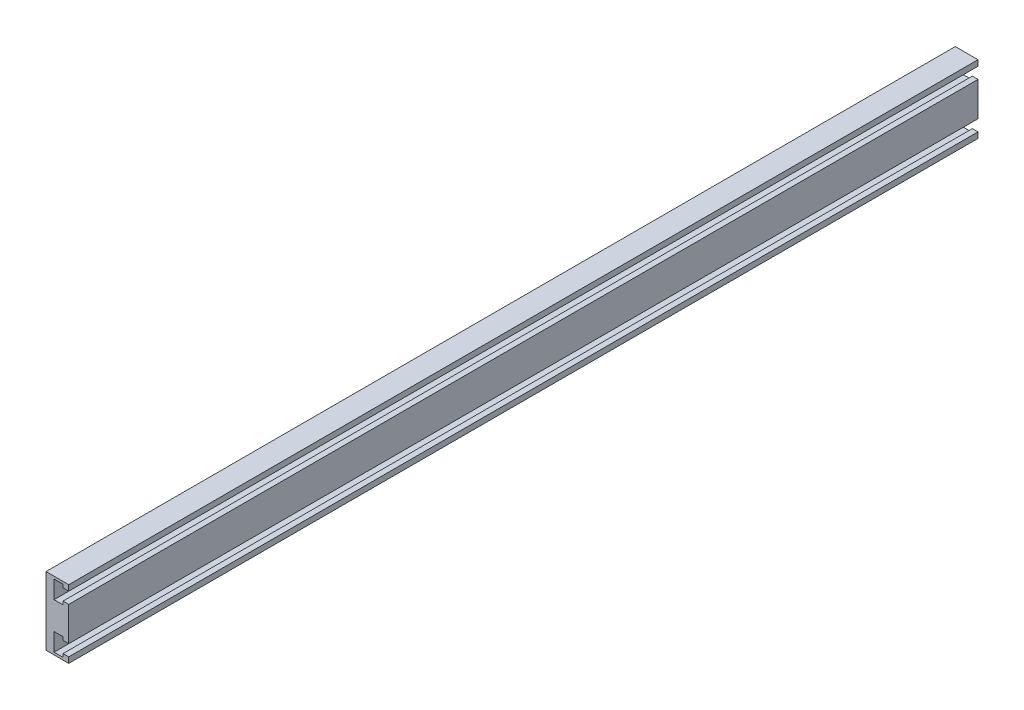
from build123d import *

# Parameters (mm, degrees)
BOSS_EXTRUDE1_DEPTH      = 254
BOSS_EXTRUDE1_DEPTH_BACK = 254


with BuildPart() as part:
    # Sketch1 → Boss-Extrude1 (new, two sides: drawn at the far end of the back side and taken through both)
    with BuildSketch(Plane.XY.offset(-BOSS_EXTRUDE1_DEPTH_BACK)):
        Polygon((6.35, -19.05), (6.35, -15.875), (3.175, -15.875), (3.175, -17.7), (-1.825, -17.7), (-1.825, -7.7), (3.175, -7.7), (3.175, -9.525), (6.35, -9.525), (6.35, 9.525), (3.175, 9.525), (3.175, 7.7), (-1.825, 7.7), (-1.825, 17.7), (3.175, 17.7), (3.175, 15.875), (6.35, 15.875), (6.35, 19.05), (-6.35, 19.05), (-6.35, -19.05), align=None)
    extrude(amount=BOSS_EXTRUDE1_DEPTH + BOSS_EXTRUDE1_DEPTH_BACK)


solid = part.part
